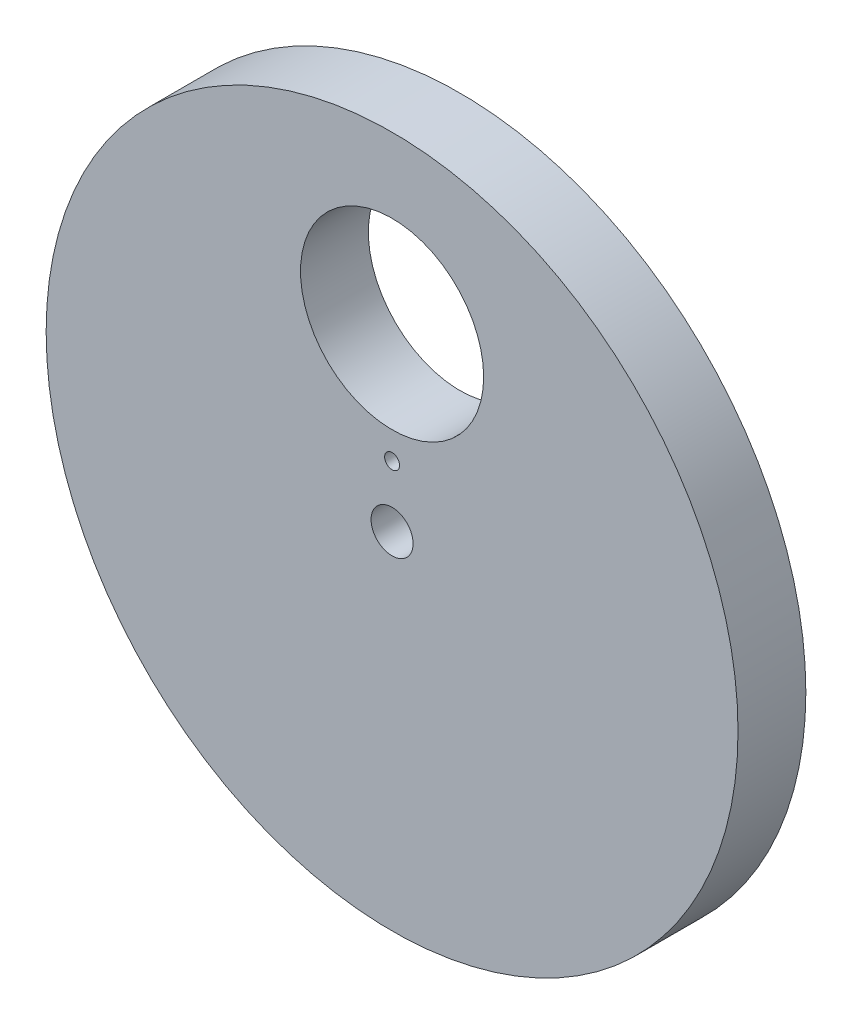
from build123d import *

# Parameters (mm, degrees)
SKIZZE1_R                            = 25.5
AUFSATZ_LINEAR_AUSTRAGEN1_DEPTH      = 5
SCHNITT_LINEAR_AUSTRAGEN1_DEPTH      = 37.407416827
SCHNITT_LINEAR_AUSTRAGEN1_DEPTH_BACK = 37.407416827
SKIZZE2_R                            = 1.55
SKIZZE2_R_2                          = 0.55
SKIZZE2_R_3                          = 6.75


with BuildPart() as part:
    # Skizze1 → Aufsatz-Linear austragen1 (new body)
    with BuildSketch(Plane.XY):
        Circle(SKIZZE1_R)
    extrude(amount=AUFSATZ_LINEAR_AUSTRAGEN1_DEPTH)

    # Skizze2 → Schnitt-Linear austragen1 (cut, two sides: drawn at the far end of the back side and taken through both)
    with BuildSketch(Plane.XY.offset(5).offset(-SCHNITT_LINEAR_AUSTRAGEN1_DEPTH_BACK)):
        Circle(SKIZZE2_R)
        with Locations((0, 4.5)):
            Circle(SKIZZE2_R_2)
        with Locations((0, 13.25)):
            Circle(SKIZZE2_R_3)
    extrude(amount=SCHNITT_LINEAR_AUSTRAGEN1_DEPTH + SCHNITT_LINEAR_AUSTRAGEN1_DEPTH_BACK, mode=Mode.SUBTRACT)


solid = part.part
